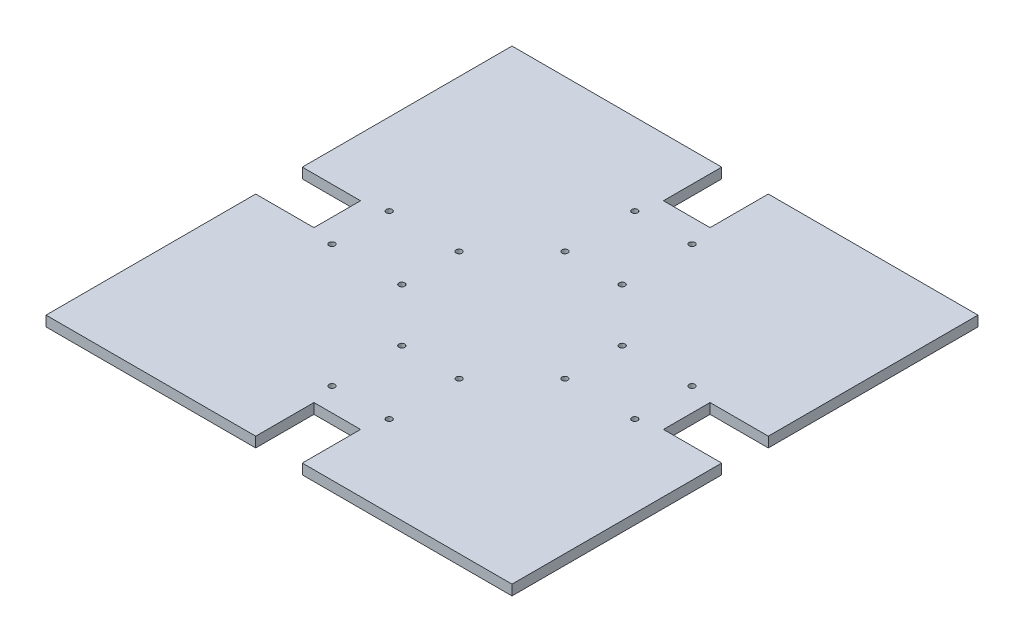
from build123d import *

# Parameters (mm, degrees)
SKETCH1_W           = 254
SKETCH1_H           = 254
BOSS_EXTRUDE1_DEPTH = 5.588
SKETCH2_R           = 1.6
SKETCH2_W           = 31.75
SKETCH2_H           = 25.4
SKETCH2_W_2         = 25.4
SKETCH2_H_2         = 31.75
CUT_EXTRUDE1_DEPTH  = 180.692030274


with BuildPart() as part:
    # Sketch1 → Boss-Extrude1 (new body)
    with BuildSketch(Plane(origin=(0, 0, 0), x_dir=(1, 0, 0), z_dir=(0, 1, 0))):
        Rectangle(SKETCH1_W, SKETCH1_H)
    extrude(amount=BOSS_EXTRUDE1_DEPTH)

    # Sketch2 → Cut-Extrude1 (cut, through all)
    with BuildSketch(Plane(origin=(0, 5.588, 0), x_dir=(1, 0, 0), z_dir=(0, 1, 0))):
        with Locations(Location((-82.55, 15.6, 0), (0, 0, 270))):
            Circle(SKETCH2_R)
        with Locations(Location((-44.45, 15.6, 0), (0, 0, 270))):
            Circle(SKETCH2_R)
        with Locations(Location((-82.55, -15.6, 0), (0, 0, 270))):
            Circle(SKETCH2_R)
        with Locations(Location((-44.45, -15.6, 0), (0, 0, 270))):
            Circle(SKETCH2_R)
        with Locations(Location((-15.6, -44.45, 0), (0, 0, 270))):
            Circle(SKETCH2_R)
        with Locations(Location((15.6, -44.45, 0), (0, 0, 270))):
            Circle(SKETCH2_R)
        with Locations(Location((-15.6, -82.55, 0), (0, 0, 270))):
            Circle(SKETCH2_R)
        with Locations(Location((15.6, -82.55, 0), (0, 0, 270))):
            Circle(SKETCH2_R)
        with Locations(Location((44.45, -15.6, 0), (0, 0, 270))):
            Circle(SKETCH2_R)
        with Locations(Location((44.45, 15.6, 0), (0, 0, 270))):
            Circle(SKETCH2_R)
        with Locations(Location((82.55, 15.6, 0), (0, 0, 270))):
            Circle(SKETCH2_R)
        with Locations(Location((82.55, -15.6, 0), (0, 0, 270))):
            Circle(SKETCH2_R)
        with Locations(Location((-15.6, 44.45, 0), (0, 0, 270))):
            Circle(SKETCH2_R)
        with Locations(Location((-15.6, 82.55, 0), (0, 0, 270))):
            Circle(SKETCH2_R)
        with Locations(Location((15.6, 82.55, 0), (0, 0, 270))):
            Circle(SKETCH2_R)
        with Locations(Location((15.6, 44.45, 0), (0, 0, 270))):
            Circle(SKETCH2_R)
        with Locations((-111.125, 0)):
            Rectangle(SKETCH2_W, SKETCH2_H)
        with Locations((0, 111.125)):
            Rectangle(SKETCH2_W_2, SKETCH2_H_2)
        with Locations((111.125, 0)):
            Rectangle(SKETCH2_W, SKETCH2_H)
        with Locations((0, -111.125)):
            Rectangle(SKETCH2_W_2, SKETCH2_H_2)
    extrude(amount=-CUT_EXTRUDE1_DEPTH, mode=Mode.SUBTRACT)


solid = part.part
